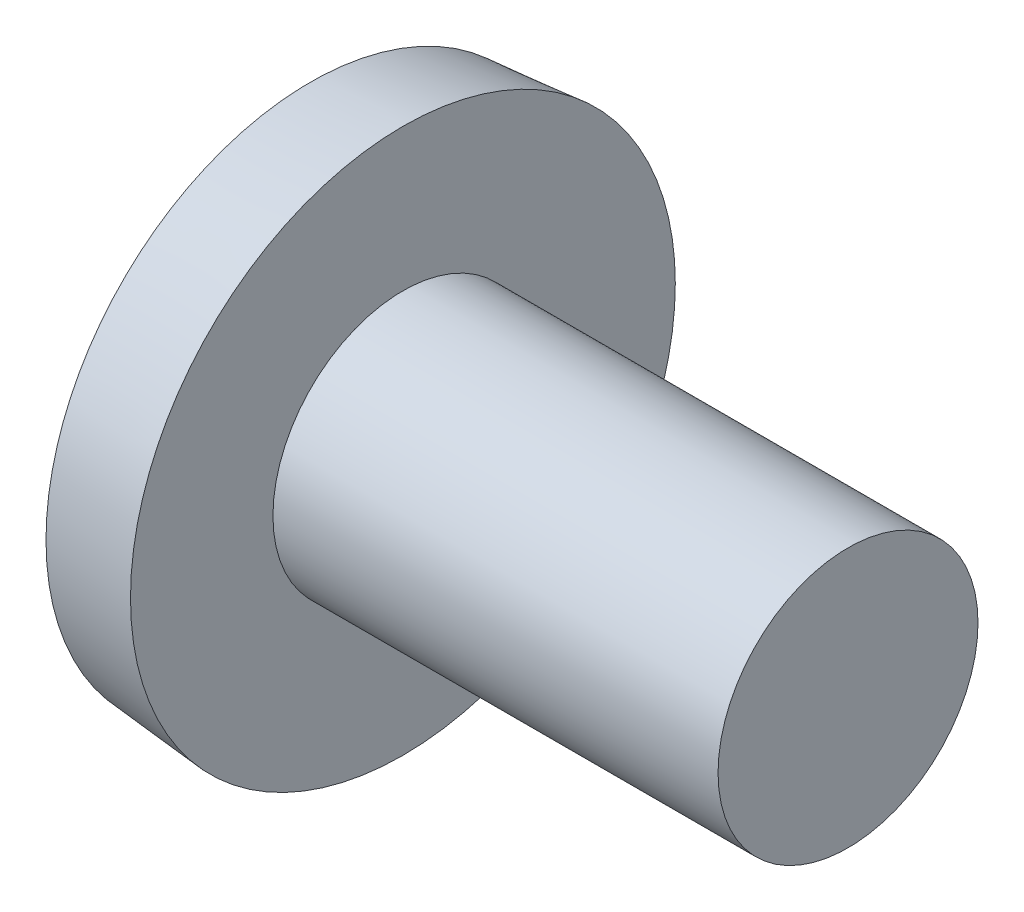
from build123d import *

# Parameters (mm, degrees)
CIRPATTERN1_COUNT = 2
CIRPATTERN1_ANGLE = 90


with BuildPart() as part:
    # BodySke → Base-Revolve (revolve)
    with BuildSketch(Plane.XY, mode=Mode.PRIVATE) as base_revolve_sk:
        with BuildLine():
            Line((1.0414, 0.9271), (1.0414, 1.9431))
            Line((1.0414, 1.9431), (0.381, 1.885322487))
            ThreePointArc((0.381, 1.885322487), (0.096203122, 0.961717458), (0, 0))
            Line((0, 0), (4.2164, 0))
            Line((4.2164, 0), (4.2164, 0.9271))
            Line((4.2164, 0.9271), (1.0414, 0.9271))
        make_face()
    revolve(base_revolve_sk.sketch.rotate(Axis((-25.4, 0, 0), (1, 0, 0)), 90), axis=Axis((-25.4, 0, 0), (1, 0, 0)))

    # Sketch3 → Cross section 0
    with BuildSketch(Plane(origin=(0, 0, 0), x_dir=(0, 0, -1), z_dir=(1, 0, 0))):
        with BuildLine():
            Line((-0.3175, 1.2319), (0.3175, 1.2319))
            Line((0.3175, 1.2319), (0.3175, -1.2319))
            Line((0.3175, -1.2319), (-0.3175, -1.2319))
            Line((-0.3175, -1.2319), (-0.3175, 1.2319))
        make_face()
    # Sketch4 → Cross section 1
    with BuildSketch(Plane(origin=(1.2954, 0, 0), x_dir=(0, 0, -1), z_dir=(1, 0, 0))):
        with BuildLine():
            Line((-0.15875, 0.15875), (0.15875, 0.15875))
            Line((0.15875, 0.15875), (0.15875, -0.15875))
            Line((0.15875, -0.15875), (-0.15875, -0.15875))
            Line((-0.15875, -0.15875), (-0.15875, 0.15875))
        make_face()
    cross = loft(mode=Mode.SUBTRACT)

    # CirPattern1: Cross ×2 about axis
    cirpattern1_axis = Axis((0, 0, 0), (1, 0, 0))
    for i in range(1, CIRPATTERN1_COUNT):
        add(cross.rotate(cirpattern1_axis, i * CIRPATTERN1_ANGLE / (CIRPATTERN1_COUNT - 1)), mode=Mode.SUBTRACT)


solid = part.part
